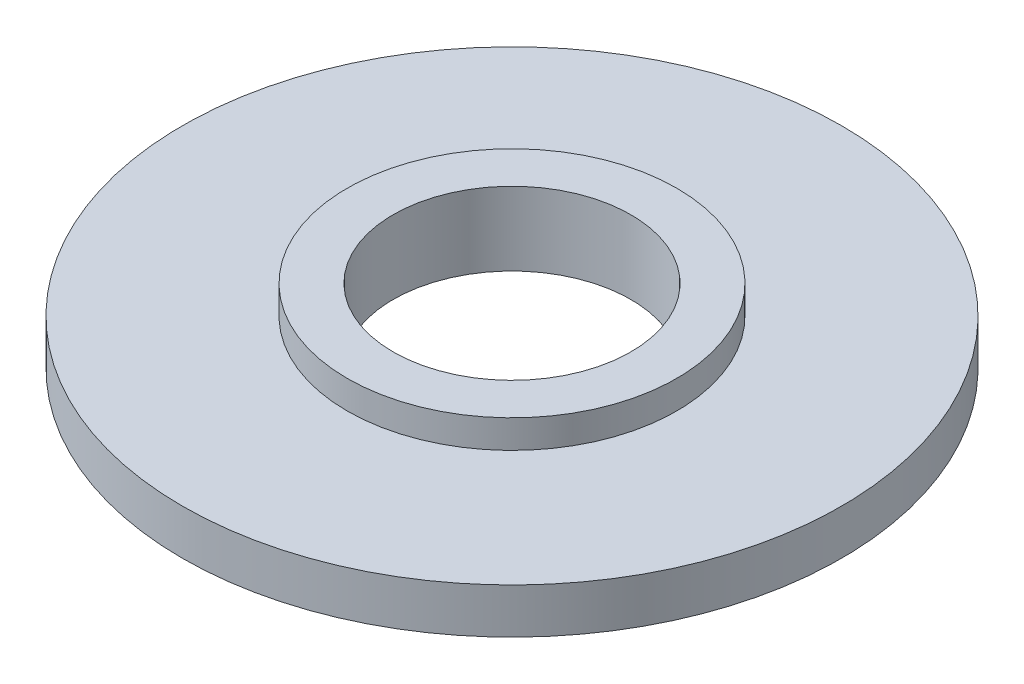
from build123d import *

# Parameters (mm, degrees)
SKETCH1_R           = 14
SKETCH1_R_2         = 5.05
BOSS_EXTRUDE1_DEPTH = 1.92
SKETCH2_R           = 7
SKETCH2_R_2         = 5.05
BOSS_EXTRUDE2_DEPTH = 1.2


with BuildPart() as part:
    # Sketch1 → Boss-Extrude1 (new body)
    with BuildSketch(Plane(origin=(0, 0, 0), x_dir=(1, 0, 0), z_dir=(0, 1, 0))):
        with Locations(Location((0, 0, 0), (0, 0, 270))):
            Circle(SKETCH1_R)
        with Locations(Location((0, 0, 0), (0, 0, 270))):
            Circle(SKETCH1_R_2, mode=Mode.SUBTRACT)
    extrude(amount=BOSS_EXTRUDE1_DEPTH)

    # Sketch2 → Boss-Extrude2 (add)
    with BuildSketch(Plane(origin=(0, 1.92, 0), x_dir=(1, 0, 0), z_dir=(0, 1, 0))):
        with Locations(Location((0, 0, 0), (0, 0, 270))):
            Circle(SKETCH2_R)
        with Locations(Location((0, 0, 0), (0, 0, 270))):
            Circle(SKETCH2_R_2, mode=Mode.SUBTRACT)
    extrude(amount=BOSS_EXTRUDE2_DEPTH)


solid = part.part
